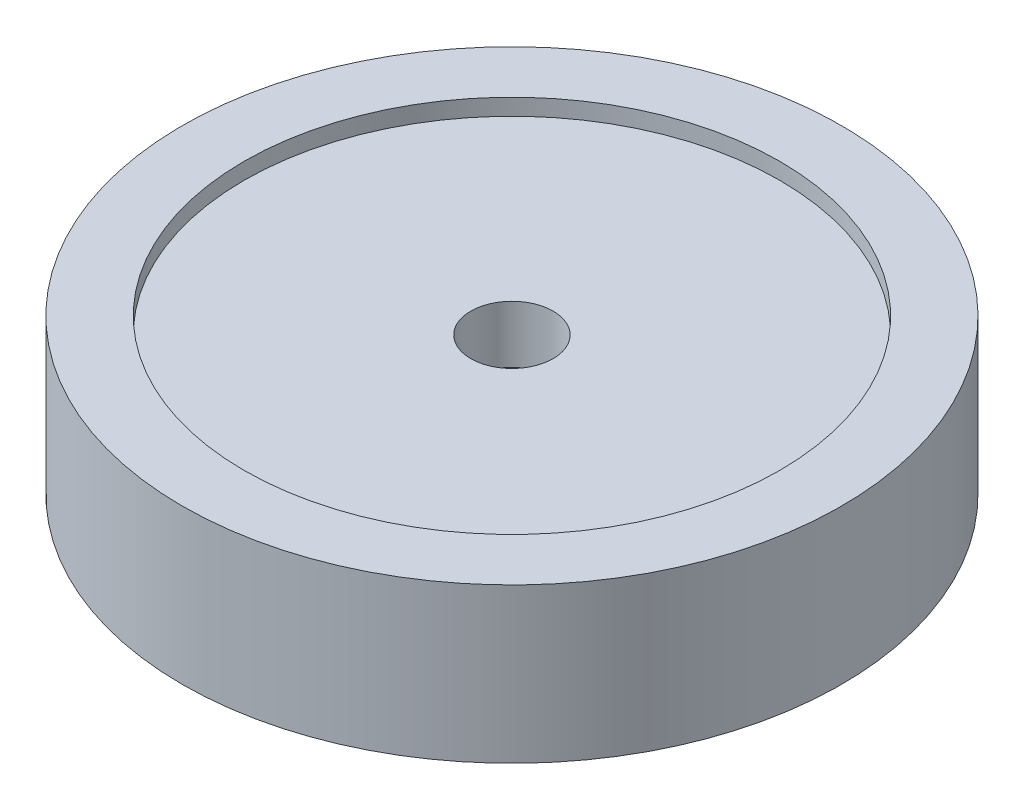
from build123d import *

# Parameters (mm, degrees)
SKETCH1_R               = 40
BOSS_EXTRUDE1_DEPTH     = 18.75
SKETCH1_3_W             = 23
SKETCH1_3_H             = 43
CUT_EXTRUDE1_DEPTH      = 9.8
CUT_EXTRUDE2_DEPTH      = 60.594987205
CUT_EXTRUDE2_DEPTH_BACK = 60.594987205
SKETCH1_4_R             = 5
CUT_EXTRUDE3_START      = 18.75
SKETCH1_5_R             = 32.5
CUT_EXTRUDE3_DEPTH      = 2


with BuildPart() as part:
    # Sketch1 → Boss-Extrude1 (new body)
    with BuildSketch(Plane(origin=(0, 0, 0), x_dir=(1, 0, 0), z_dir=(0, 1, 0))):
        with Locations(Location((0, 0, 0), (0, 0, 270))):
            Circle(SKETCH1_R)
    extrude(amount=BOSS_EXTRUDE1_DEPTH)

    # Sketch1<3> → Cut-Extrude1 (cut)
    with BuildSketch(Plane(origin=(0, 0, 0), x_dir=(1, 0, 0), z_dir=(0, 1, 0))):
        with Locations((0, -10)):
            Rectangle(SKETCH1_3_W, SKETCH1_3_H)
    extrude(amount=CUT_EXTRUDE1_DEPTH, mode=Mode.SUBTRACT)

    # Sketch1<4> → Cut-Extrude2 (cut, two sides: drawn at the far end of the back side and taken through both)
    with BuildSketch(Plane(origin=(0, 0, 0), x_dir=(1, 0, 0), z_dir=(0, 1, 0)).offset(-CUT_EXTRUDE2_DEPTH_BACK)):
        with Locations(Location((0, 0, 0), (0, 0, 270))):
            Circle(SKETCH1_4_R)
    extrude(amount=CUT_EXTRUDE2_DEPTH + CUT_EXTRUDE2_DEPTH_BACK, mode=Mode.SUBTRACT)

    # Sketch1<5> → Cut-Extrude3 (cut)
    with BuildSketch(Plane(origin=(0, 0, 0), x_dir=(1, 0, 0), z_dir=(0, 1, 0)).offset(CUT_EXTRUDE3_START)):
        with Locations(Location((0, 0, 0), (0, 0, 270))):
            Circle(SKETCH1_5_R)
    extrude(amount=-CUT_EXTRUDE3_DEPTH, mode=Mode.SUBTRACT)


solid = part.part
